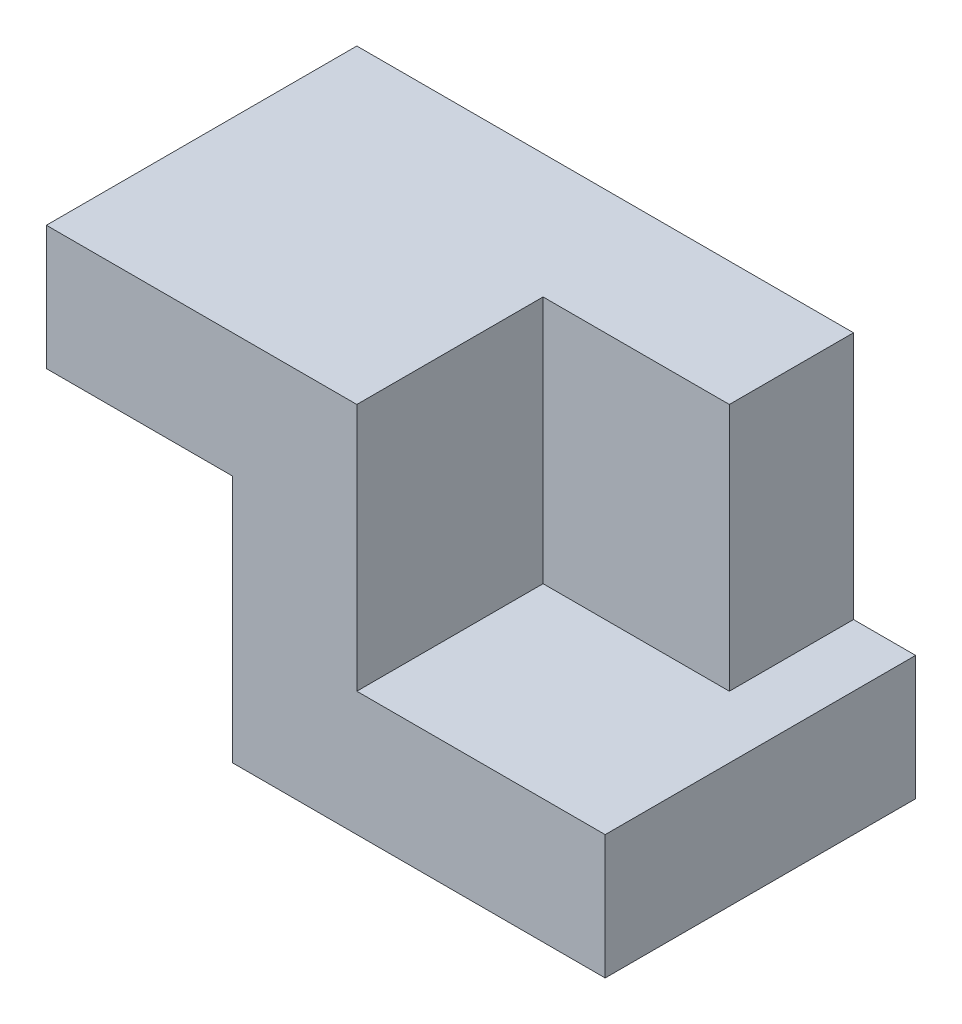
from build123d import *

# Parameters (mm, degrees)
CROQUIS2_W              = 90
CROQUIS2_H              = 60
SALIENTE_EXTRUIR1_DEPTH = 50
CROQUIS3_W              = 50
CROQUIS3_H              = 40
CORTAR_EXTRUIR3_DEPTH   = 30
CROQUIS5_W              = 30
CROQUIS5_H              = 30
CORTAR_EXTRUIR4_DEPTH   = 40


with BuildPart() as part:
    # Croquis2 → Saliente-Extruir1 (new body)
    with BuildSketch(Plane.XY):
        Rectangle(CROQUIS2_W, CROQUIS2_H)
    extrude(amount=SALIENTE_EXTRUIR1_DEPTH)

    # Croquis3 → Cortar-Extruir3 (cut)
    with BuildSketch(Plane.ZY.offset(45)):
        with Locations((25, -10)):
            Rectangle(CROQUIS3_W, CROQUIS3_H)
    extrude(amount=-CORTAR_EXTRUIR3_DEPTH, mode=Mode.SUBTRACT)

    # Croquis5 → Cortar-Extruir4 (cut)
    with BuildSketch(Plane(origin=(0, 30, 0), x_dir=(1, 0, 0), z_dir=(0, 1, 0))):
        with Locations((20, -35)):
            Rectangle(CROQUIS5_W, CROQUIS5_H)
        Polygon((45, -50), (45, 0), (35, 0), (35, -20), (35, -50), align=None)
    extrude(amount=-CORTAR_EXTRUIR4_DEPTH, mode=Mode.SUBTRACT)


solid = part.part
